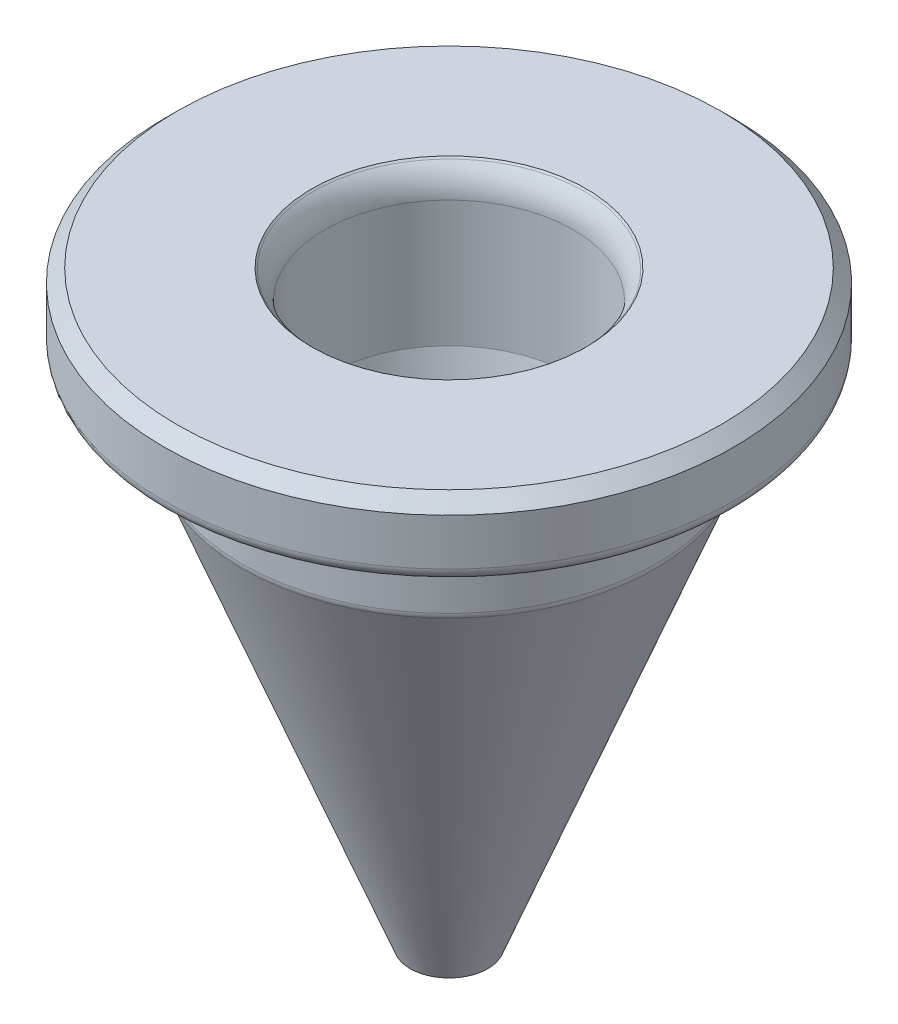
from build123d import *

# Parameters (mm, degrees)
FL_CHE_VERSCHIEBEN1_BY          = 1
AUFSATZ_LINEAR_START            = -2.8
SKIZZE2_R                       = 11
SKIZZE2_R_2                     = 4.8
AUFSATZ_LINEAR_AUSTRAGEN1_DEPTH = 2.8
VERRUNDUNG1_R                   = 0.5
FASE1_SIZE                      = 0.5
VERRUNDUNG2_R                   = 1.5


with BuildPart() as part:
    # Skizze1 → Rotation1 (revolve)
    with BuildSketch(Plane.XY, mode=Mode.PRIVATE) as rotation1_sk:
        Polygon((1, 0), (4.8, 17), (4.8, 22), (8, 22), (8, 17), (1.5, 0.3), align=None)
    revolve(rotation1_sk.sketch.rotate(Axis((0, 0, 0), (0, 1, 0)), 270), axis=Axis((0, 0, 0), (0, 1, 0)))

    # Fläche verschieben1: a face moved outward by 1.0
    extrude(part.faces().sort_by_distance((-6.4, 22, 0))[0], amount=FL_CHE_VERSCHIEBEN1_BY, dir=(0, 1, 0))

    # Skizze2 → Aufsatz-Linear austragen1 (add)
    with BuildSketch(Plane(origin=(0, 23, 0), x_dir=(1, 0, 0), z_dir=(0, 1, 0)).offset(AUFSATZ_LINEAR_START)):
        with Locations(Location((0, 0, 0), (0, 0, 270))):
            Circle(SKIZZE2_R)
        with Locations(Location((0, 0, 0), (0, 0, 270))):
            Circle(SKIZZE2_R_2, mode=Mode.SUBTRACT)
    extrude(amount=AUFSATZ_LINEAR_AUSTRAGEN1_DEPTH)

    # Verrundung1
    verrundung1_edges = [part.edges().sort_by_distance(p)[0] for p in [
        (0, 20.2, -8),
        (0, 20.2, -11),
        (0, 17, -8),
    ]]
    fillet(verrundung1_edges, radius=VERRUNDUNG1_R)

    # Fase1
    fase1_edges = [part.edges().sort_by_distance(p)[0] for p in [
        (0, 23, -11),
        (0, 23, -4.8),
    ]]
    chamfer(fase1_edges, length=FASE1_SIZE)

    # Verrundung2
    verrundung2_edges = [part.edges().sort_by_distance(p)[0] for p in [
        (0, 22.5, -4.8),
    ]]
    fillet(verrundung2_edges, radius=VERRUNDUNG2_R)


solid = part.part
